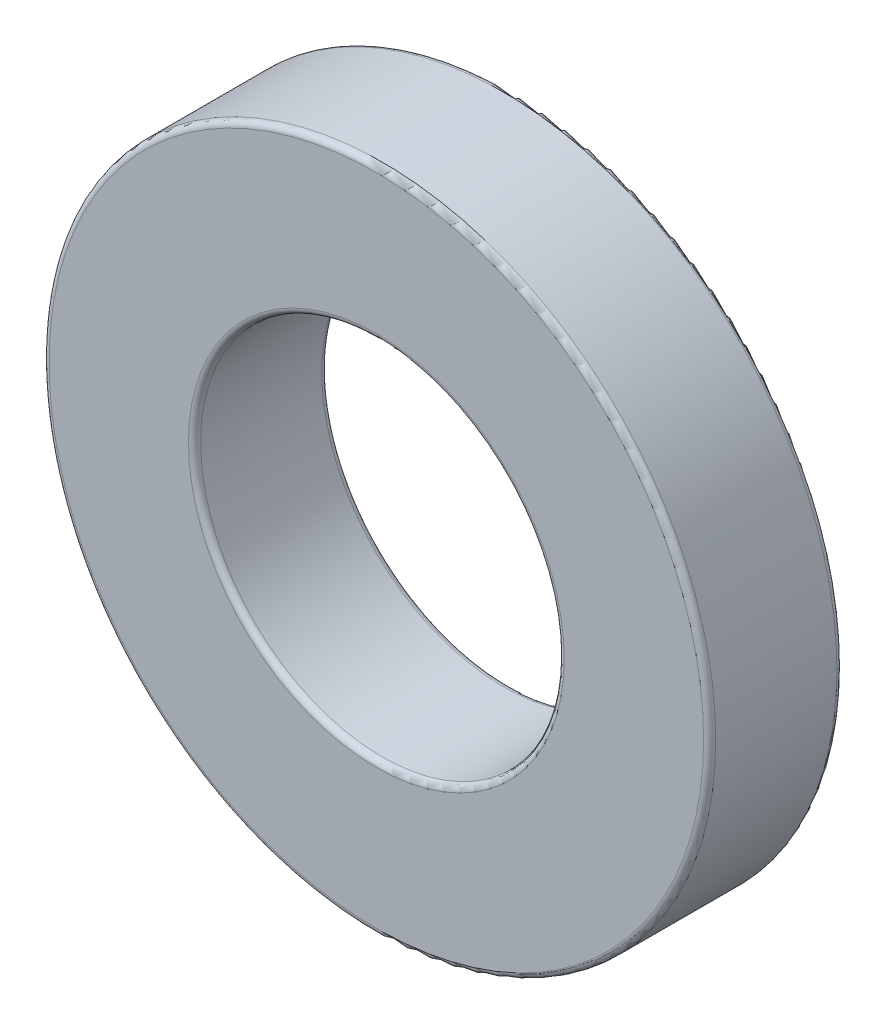
from build123d import *

# Parameters (mm, degrees)
IZIM1_R                     = 55
IZIM1_R_2                   = 30
Y_KSEKLIK_EKSTR_ZYON1_DEPTH = 22
RADYUS1_R                   = 1


with BuildPart() as part:
    # Çizim1 → Yükseklik-Ekstrüzyon1 (new body)
    with BuildSketch(Plane.XY):
        Circle(IZIM1_R)
        Circle(IZIM1_R_2, mode=Mode.SUBTRACT)
    extrude(amount=Y_KSEKLIK_EKSTR_ZYON1_DEPTH)

    # Radyus1
    radyus1_edges = [part.edges().sort_by_distance(p)[0] for p in [
        (-55, 0, 0),
        (-55, 0, 22),
        (-30, 0, 0),
        (-30, 0, 22),
    ]]
    fillet(radyus1_edges, radius=RADYUS1_R)


solid = part.part
